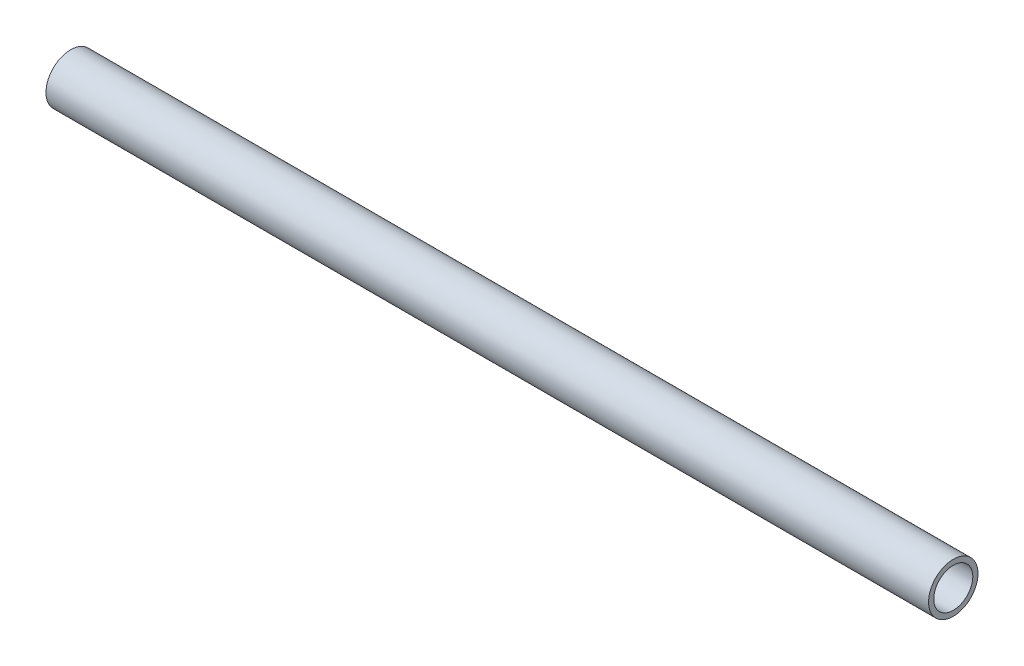
from build123d import *

# Parameters (mm, degrees)
SKETCH1_R           = 9.525
SKETCH1_R_2         = 7.525
BOSS_EXTRUDE1_DEPTH = 340


with BuildPart() as part:
    # Sketch1 → Boss-Extrude1 (new body)
    with BuildSketch(Plane(origin=(0, 0, 0), x_dir=(0, 0, -1), z_dir=(1, 0, 0))):
        Circle(SKETCH1_R)
        Circle(SKETCH1_R_2, mode=Mode.SUBTRACT)
    extrude(amount=BOSS_EXTRUDE1_DEPTH)


solid = part.part
